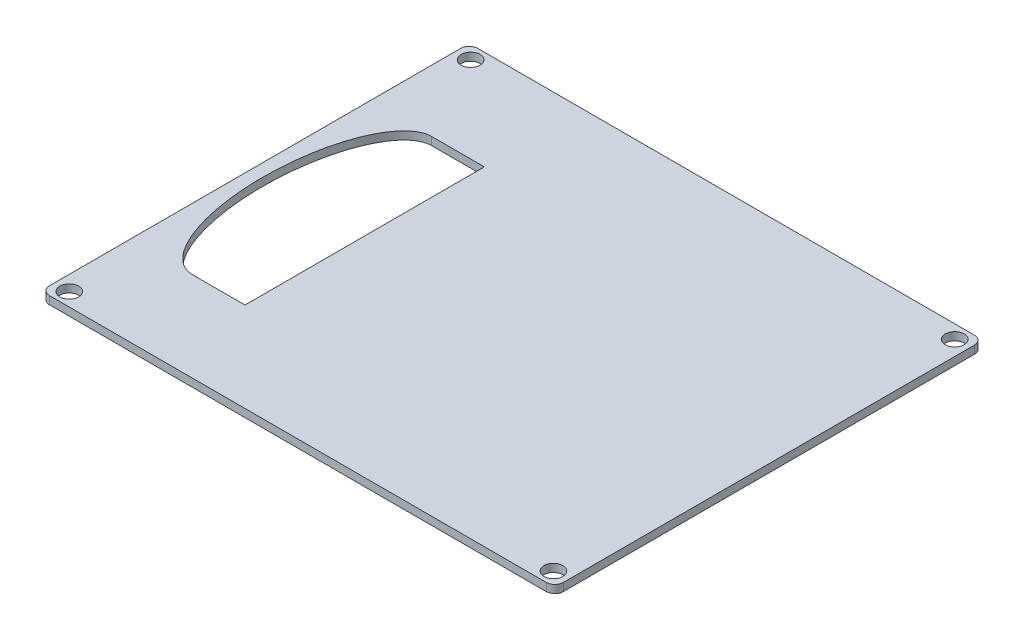
from build123d import *

# Parameters (mm, degrees)
SKETCH1_W           = 152.4
SKETCH1_H           = 127
BOSS_EXTRUDE1_DEPTH = 2.3622
SKETCH2_R           = 2.794
CUT_EXTRUDE1_DEPTH  = 100.218294628
FILLET1_R           = 2.54
SKETCH4_W           = 15.599974926
SKETCH4_H           = 70.968900013
CUT_EXTRUDE2_DEPTH  = 100.218294628
SKETCH5_RX          = 35.484450006
SKETCH5_RY          = 14.605
CUT_EXTRUDE3_DEPTH  = 100.218294628


with BuildPart() as part:
    # Sketch1 → Boss-Extrude1 (new body)
    with BuildSketch(Plane(origin=(0, 0, 0), x_dir=(1, 0, 0), z_dir=(0, 1, 0))):
        Rectangle(SKETCH1_W, SKETCH1_H)
    extrude(amount=BOSS_EXTRUDE1_DEPTH)

    # Sketch2 → Cut-Extrude1 (cut, through all)
    with BuildSketch(Plane(origin=(0, 2.3622, 0), x_dir=(1, 0, 0), z_dir=(0, 1, 0))):
        with Locations(Location((71.794813785, -59.510435834, 0), (0, 0, 270))):
            Circle(SKETCH2_R)
        with Locations(Location((71.794813785, 59.510435834, 0), (0, 0, 270))):
            Circle(SKETCH2_R)
    cut_extrude1 = extrude(amount=-CUT_EXTRUDE1_DEPTH, mode=Mode.SUBTRACT)

    # Mirror1: Cut-Extrude1 across plane
    add(cut_extrude1.mirror(Plane(origin=(0, 0, 0), x_dir=(0, 0, 1), z_dir=(1, 0, 0))), mode=Mode.SUBTRACT)

    # Fillet1
    fillet1_edges = [part.edges().sort_by_distance(p)[0] for p in [
        (76.2, 1.1811, 63.5),
        (-76.2, 1.1811, 63.5),
        (-76.2, 1.1811, -63.5),
        (76.2, 1.1811, -63.5),
    ]]
    fillet(fillet1_edges, radius=FILLET1_R)

    # Sketch4 → Cut-Extrude2 (cut, through all)
    with BuildSketch(Plane(origin=(0, 2.3622, 0), x_dir=(1, 0, 0), z_dir=(0, 1, 0))):
        with Locations((-50.05790393, -1.440073651)):
            Rectangle(SKETCH4_W, SKETCH4_H)
    extrude(amount=-CUT_EXTRUDE2_DEPTH, mode=Mode.SUBTRACT)

    # Sketch5 → Cut-Extrude3 (cut, through all)
    with BuildSketch(Plane(origin=(0, 2.3622, 0), x_dir=(1, 0, 0), z_dir=(0, 1, 0))):
        with Locations(Location((-57.857891393, -1.44007365), (0, 0, -90))):
            Ellipse(SKETCH5_RX, SKETCH5_RY)
    extrude(amount=-CUT_EXTRUDE3_DEPTH, mode=Mode.SUBTRACT)


solid = part.part
